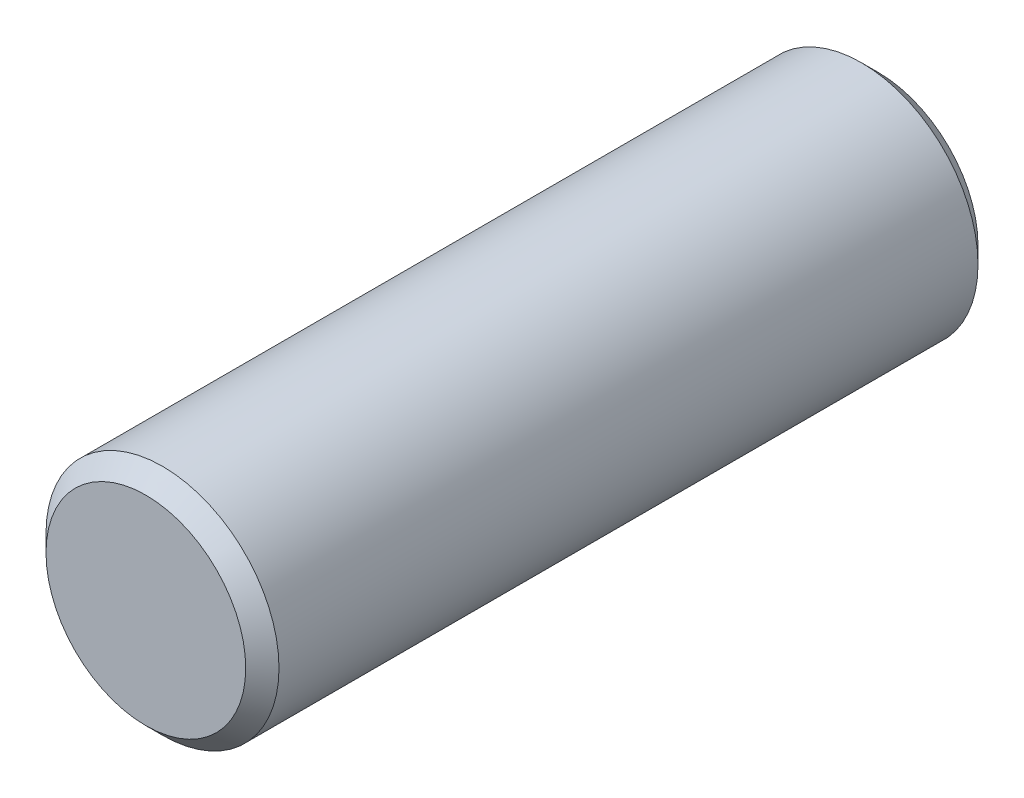
from build123d import *

# Parameters (mm, degrees)
BASE_EXTRUSION_START = -22
ESQUISSE1_R          = 3.5
BASE_EXTRUSION_DEPTH = 22
CHANFREIN1_SIZE      = 0.5


with BuildPart() as part:
    # Esquisse1 → Base-Extrusion (new body)
    with BuildSketch(Plane.XY.offset(BASE_EXTRUSION_START)):
        Circle(ESQUISSE1_R)
    extrude(amount=BASE_EXTRUSION_DEPTH)

    # Chanfrein1
    chanfrein1_edges = [part.edges().sort_by_distance(p)[0] for p in [
        (-3.5, 0, 0),
        (-3.5, 0, -22),
    ]]
    chamfer(chanfrein1_edges, length=CHANFREIN1_SIZE)


solid = part.part
